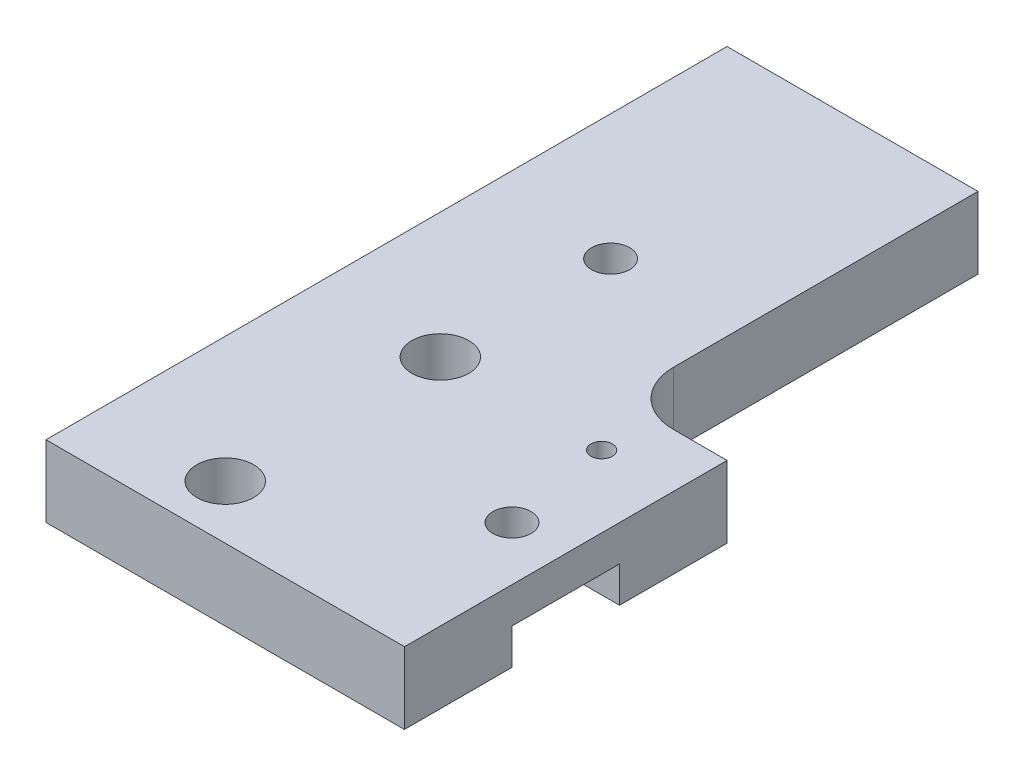
from build123d import *

# Parameters (mm, degrees)
SKETCH1_W               = 63.5
SKETCH1_H               = 57.15
BOSS_EXTRUDE1_DEPTH     = 12.7
SKETCH2_W               = 63.5
SKETCH2_H               = 19.05
CUT_EXTRUDE1_DEPTH      = 6.35
F_3_8_CLEARANCE_HOLE1_D = 10.0838
SKETCH10_W              = 63.5
SKETCH10_H              = 12.7
BOSS_EXTRUDE2_DEPTH     = 63.5
SKETCH11_W              = 19.05
SKETCH11_H              = 60.325
CUT_EXTRUDE3_DEPTH      = 6.35
FILLET1_R               = 4.7625
F_1_4_CLEARANCE_HOLE1_D = 6.7564
SKETCH13_W              = 19.05
SKETCH13_H              = 63.5
CUT_EXTRUDE5_DEPTH      = 99.219947694
FILLET2_R               = 9.525
F_10_24_TAPPED_HOLE1_D  = 3.7973


with BuildPart() as part:
    # Sketch1 → Boss-Extrude1 (new body)
    with BuildSketch(Plane(origin=(0, 0, 0), x_dir=(1, 0, 0), z_dir=(0, 1, 0))):
        Rectangle(SKETCH1_W, SKETCH1_H)
    extrude(amount=BOSS_EXTRUDE1_DEPTH)

    # Sketch2 → Cut-Extrude1 (cut)
    with BuildSketch(Plane.XZ):
        Rectangle(SKETCH2_W, SKETCH2_H)
    extrude(amount=-CUT_EXTRUDE1_DEPTH, mode=Mode.SUBTRACT)

    # 3/8 Clearance Hole1 (through all)
    with Locations(Plane(origin=(0, 12.7, 0), x_dir=(1, 0, 0), z_dir=(0, 1, 0))):
        with Locations((-9.525, 19.05), (-9.525, -19.05)):
            Hole(F_3_8_CLEARANCE_HOLE1_D / 2)

    # Sketch10 → Boss-Extrude2 (add)
    with BuildSketch(Plane(origin=(0, 0, -28.575), x_dir=(-1, 0, 0), z_dir=(0, 0, -1))):
        with Locations((0, 6.35)):
            Rectangle(SKETCH10_W, SKETCH10_H)
    extrude(amount=BOSS_EXTRUDE2_DEPTH)

    # Sketch11 → Cut-Extrude3 (cut)
    with BuildSketch(Plane.XZ):
        with Locations((-9.525, -61.9125)):
            Rectangle(SKETCH11_W, SKETCH11_H)
    extrude(amount=-CUT_EXTRUDE3_DEPTH, mode=Mode.SUBTRACT)

    # Fillet1
    fillet1_edges = [part.edges().sort_by_distance(p)[0] for p in [
        (0, 3.175, -31.75),
        (-19.05, 3.175, -31.75),
    ]]
    fillet(fillet1_edges, radius=FILLET1_R)

    # 1/4 Clearance Hole1 (through all)
    with Locations(Plane(origin=(0, 6.35, 0), x_dir=(-1, 0, 0), z_dir=(0, -1, 0))):
        with Locations((-22.225, 0), (9.525, 49.2125)):
            Hole(F_1_4_CLEARANCE_HOLE1_D / 2)

    # Sketch13 → Cut-Extrude5 (cut, through all)
    with BuildSketch(Plane.XZ):
        with Locations((22.225, -60.325)):
            Rectangle(SKETCH13_W, SKETCH13_H)
    extrude(amount=-CUT_EXTRUDE5_DEPTH, mode=Mode.SUBTRACT)

    # Fillet2
    fillet2_edges = [part.edges().sort_by_distance(p)[0] for p in [
        (12.7, 6.35, -28.575),
    ]]
    fillet(fillet2_edges, radius=FILLET2_R)

    # #10-24 Tapped Hole1 (through all)
    with Locations(Plane(origin=(0, 12.7, 0), x_dir=(1, 0, 0), z_dir=(0, 1, 0))):
        with Locations((19.05, 19.05)):
            Hole(F_10_24_TAPPED_HOLE1_D / 2)


solid = part.part
